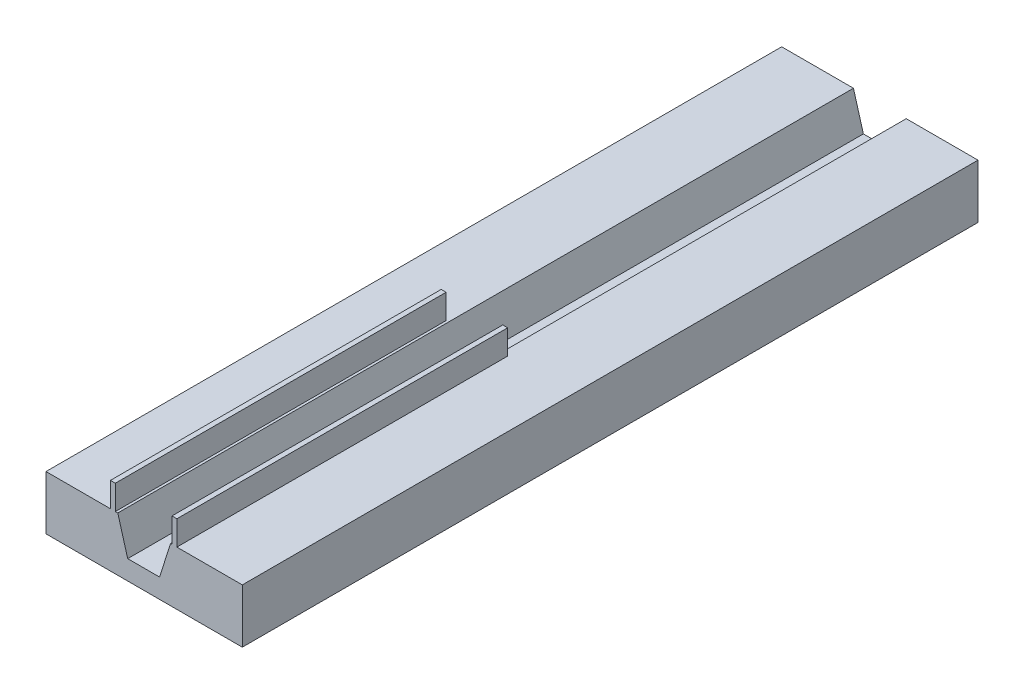
from build123d import *

# Parameters (mm, degrees)
SALIENTE_EXTRUIR1_DEPTH = 299.79
CROQUIS2_W              = 2
CROQUIS2_H              = 10
SALIENTE_EXTRUIR2_DEPTH = 134.79


with BuildPart() as part:
    # Croquis1 → Saliente-Extruir1 (new body)
    with BuildSketch(Plane.XY):
        Polygon((-6.5, 0), (6.5, 0), (10.956890061, 14.1), (40.206890061, 14.1), (40.206890061, -7.9), (-39.793109939, -7.9), (-39.793109939, 14.1), (-10.543109939, 14.1), align=None)
    extrude(amount=-SALIENTE_EXTRUIR1_DEPTH)

    # Croquis2 → Saliente-Extruir2 (add)
    with BuildSketch(Plane.XY):
        with Locations((-12.543109939, 19.1)):
            Rectangle(CROQUIS2_W, CROQUIS2_H)
    saliente_extruir2 = extrude(amount=-SALIENTE_EXTRUIR2_DEPTH)

    # Simetría1: Saliente-Extruir2 across plane
    add(saliente_extruir2.mirror(Plane(origin=(0, 0, 0), x_dir=(0, 0, 1), z_dir=(1, 0, 0))))


solid = part.part
